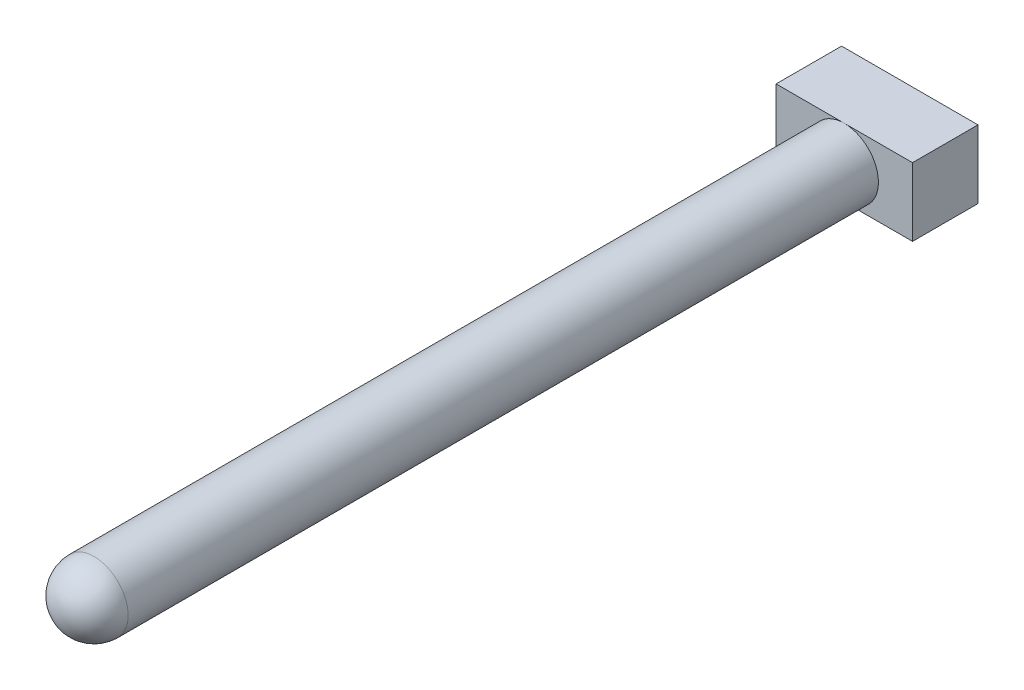
from build123d import *

# Parameters (mm, degrees)
SKETCH1_W           = 12.7
SKETCH1_H           = 6.35
BOSS_EXTRUDE1_DEPTH = 6.096
SKETCH2_R           = 3.175
BOSS_EXTRUDE2_DEPTH = 69.85


with BuildPart() as part:
    # Sketch1 → Boss-Extrude1 (new body)
    with BuildSketch(Plane.XY):
        with Locations((6.35, 3.175)):
            Rectangle(SKETCH1_W, SKETCH1_H)
    extrude(amount=BOSS_EXTRUDE1_DEPTH)

    # Sketch2 → Boss-Extrude2 (add)
    with BuildSketch(Plane.XY.offset(6.096)):
        with Locations(Location((6.35, 3.175, 0), (0, 0, 270))):
            Circle(SKETCH2_R)
    extrude(amount=BOSS_EXTRUDE2_DEPTH)

    # Sketch4 → Revolve1 (revolve)
    with BuildSketch(Plane(origin=(6.35, 0, 0), x_dir=(0, 0, -1), z_dir=(1, 0, 0))):
        with BuildLine():
            Line((-75.946, 6.35), (-75.946, 3.175))
            Line((-75.946, 3.175), (-79.121, 3.175))
            ThreePointArc((-79.121, 3.175), (-78.19106403, 5.42006403), (-75.946, 6.35))
        make_face()
    revolve(axis=Axis((6.35, 3.175, -3.95605), (0, 0, 1)))


solid = part.part
